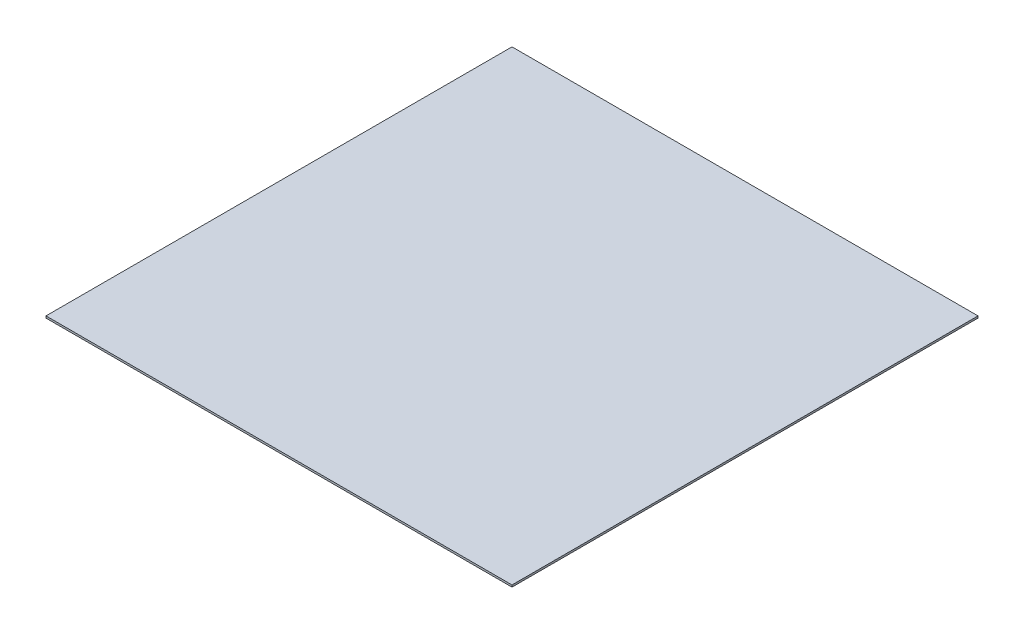
from build123d import *

# Parameters (mm, degrees)
SKETCH1_W           = 3048
SKETCH1_H           = 3048
BOSS_EXTRUDE1_DEPTH = 12.7


with BuildPart() as part:
    # Sketch1 → Boss-Extrude1 (new body)
    with BuildSketch(Plane(origin=(0, 0, 0), x_dir=(1, 0, 0), z_dir=(0, 1, 0))):
        Rectangle(SKETCH1_W, SKETCH1_H)
    extrude(amount=BOSS_EXTRUDE1_DEPTH)


solid = part.part
